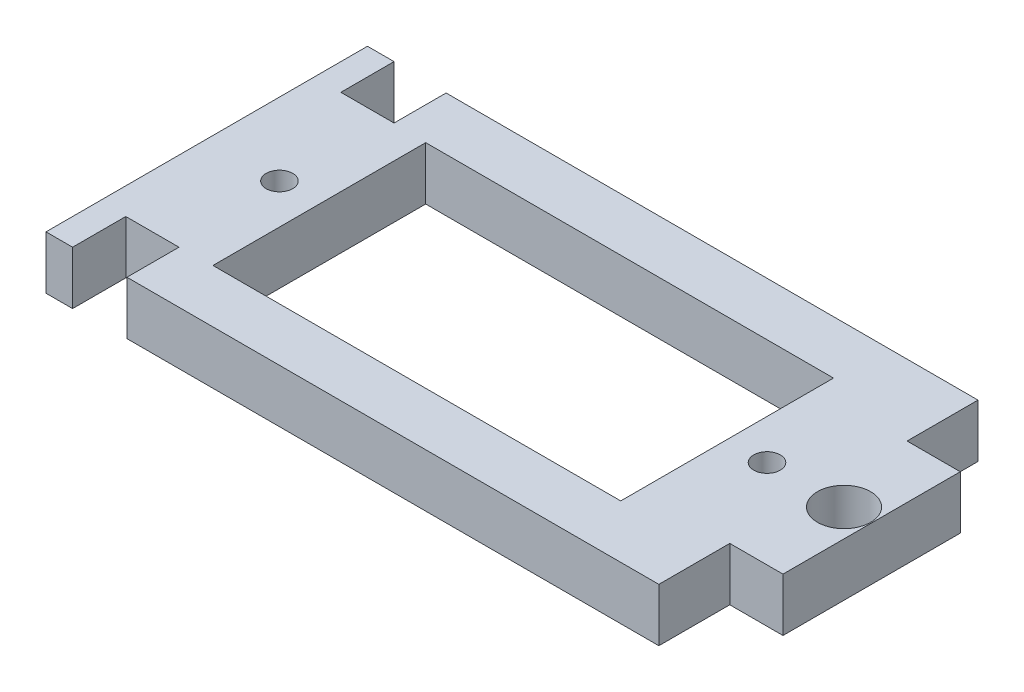
from build123d import *

# Parameters (mm, degrees)
SKETCH_1_R      = 1.5
SKETCH_1_R_2    = 0.75
SKETCH_1_W      = 23
SKETCH_1_H      = 12
EXTRUDE_3_DEPTH = 3


with BuildPart() as part:
    # 草图1 → 凸台-拉伸3 (new body)
    with BuildSketch(Plane(origin=(0, 0, 0), x_dir=(1, 0, 0), z_dir=(0, 1, 0))):
        Polygon((-15.016304348, 6.130434783), (-15.016304348, 15.130434783), (-13.516304348, 15.130434783), (-13.516304348, 12.130434783), (-10.516304348, 12.130434783), (-10.516304348, 15.065217391), (19.483695652, 15.065217391), (19.483695652, 11.065217391), (22.483695652, 11.065217391), (22.483695652, 1.065217391), (19.483695652, 1.065217391), (19.483695652, -2.934782609), (-10.516304348, -2.934782609), (-10.516304348, 0), (-13.516304348, 0), (-13.516304348, -3), (-15.016304348, -3), (-15.016304348, 6), align=None)
        with Locations(Location((20.926676996, 6.065217391, 0), (0, 0, 270))):
            Circle(SKETCH_1_R, mode=Mode.SUBTRACT)
        with Locations(Location((-10.916304348, 6.065217391, 0), (0, 0, 270))):
            Circle(SKETCH_1_R_2, mode=Mode.SUBTRACT)
        with Locations(Location((16.583695652, 6.065217391, 0), (0, 0, 270))):
            Circle(SKETCH_1_R_2, mode=Mode.SUBTRACT)
        with Locations((2.833695652, 6.065217391)):
            Rectangle(SKETCH_1_W, SKETCH_1_H, mode=Mode.SUBTRACT)
    extrude(amount=EXTRUDE_3_DEPTH)


solid = part.part
